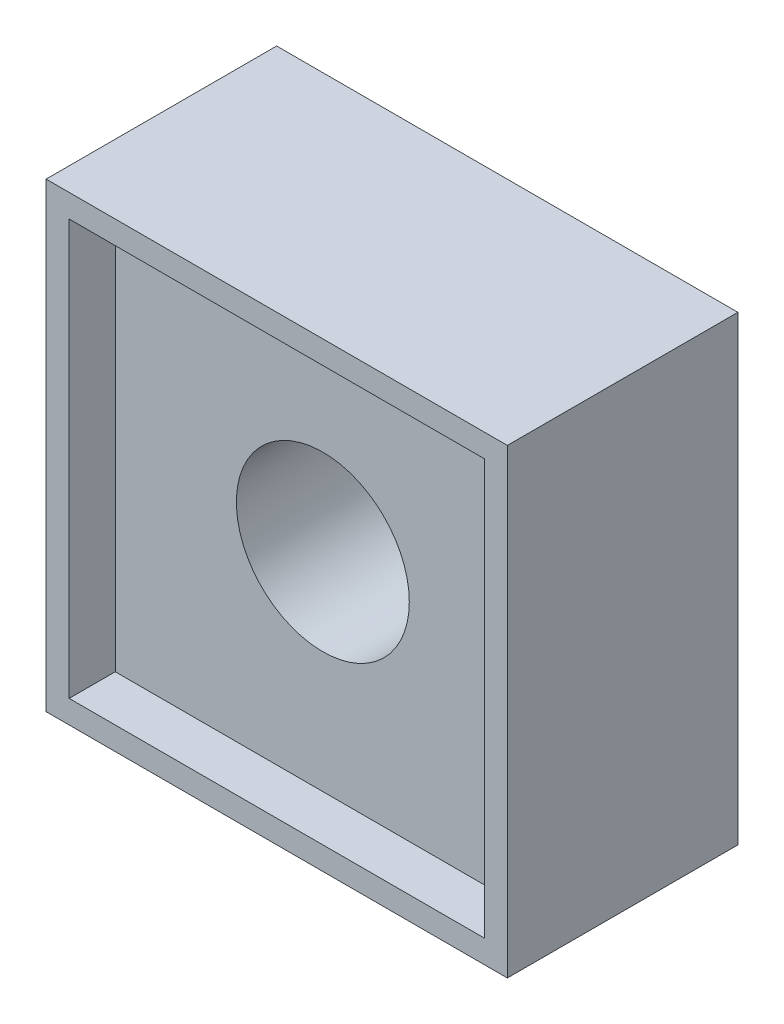
from build123d import *

# Parameters (mm, degrees)
SKETCH1_W           = 40.015172748
SKETCH1_H           = 40.015172748
BOSS_EXTRUDE1_DEPTH = 20
SKETCH1_3_R         = 8.95
SKETCH1_3_R_2       = 7.5
BOSS_EXTRUDE2_DEPTH = 3.5
SKETCH1_4_R         = 7.5
CUT_EXTRUDE1_DEPTH  = 35.649776695
SKETCH1_5_W         = 22.4
SKETCH1_5_H         = 4.3
CUT_EXTRUDE2_DEPTH  = 6.7
SKETCH7_W           = 36.015172748
SKETCH7_H           = 36.015172748
CUT_EXTRUDE3_DEPTH  = 4


with BuildPart() as part:
    # Sketch1 → Boss-Extrude1 (new body)
    with BuildSketch(Plane.XY):
        Rectangle(SKETCH1_W, SKETCH1_H)
    extrude(amount=BOSS_EXTRUDE1_DEPTH)

    # Sketch1<3> → Boss-Extrude2 (add)
    with BuildSketch(Plane.XY):
        Circle(SKETCH1_3_R)
        Circle(SKETCH1_3_R_2, mode=Mode.SUBTRACT)
    extrude(amount=-BOSS_EXTRUDE2_DEPTH)

    # Sketch1<4> → Cut-Extrude1 (cut, through all)
    with BuildSketch(Plane.XY):
        Circle(SKETCH1_4_R)
    extrude(amount=CUT_EXTRUDE1_DEPTH, mode=Mode.SUBTRACT)

    # Sketch1<5> → Cut-Extrude2 (cut)
    with BuildSketch(Plane.XY):
        with Locations((-0.1, -16.357586374)):
            Rectangle(SKETCH1_5_W, SKETCH1_5_H)
        with Locations((-0.1, 16.557586374)):
            Rectangle(SKETCH1_5_W, SKETCH1_5_H)
    extrude(amount=CUT_EXTRUDE2_DEPTH, mode=Mode.SUBTRACT)

    # Sketch7 → Cut-Extrude3 (cut)
    with BuildSketch(Plane.XY.offset(20)):
        Rectangle(SKETCH7_W, SKETCH7_H)
    extrude(amount=-CUT_EXTRUDE3_DEPTH, mode=Mode.SUBTRACT)


solid = part.part
